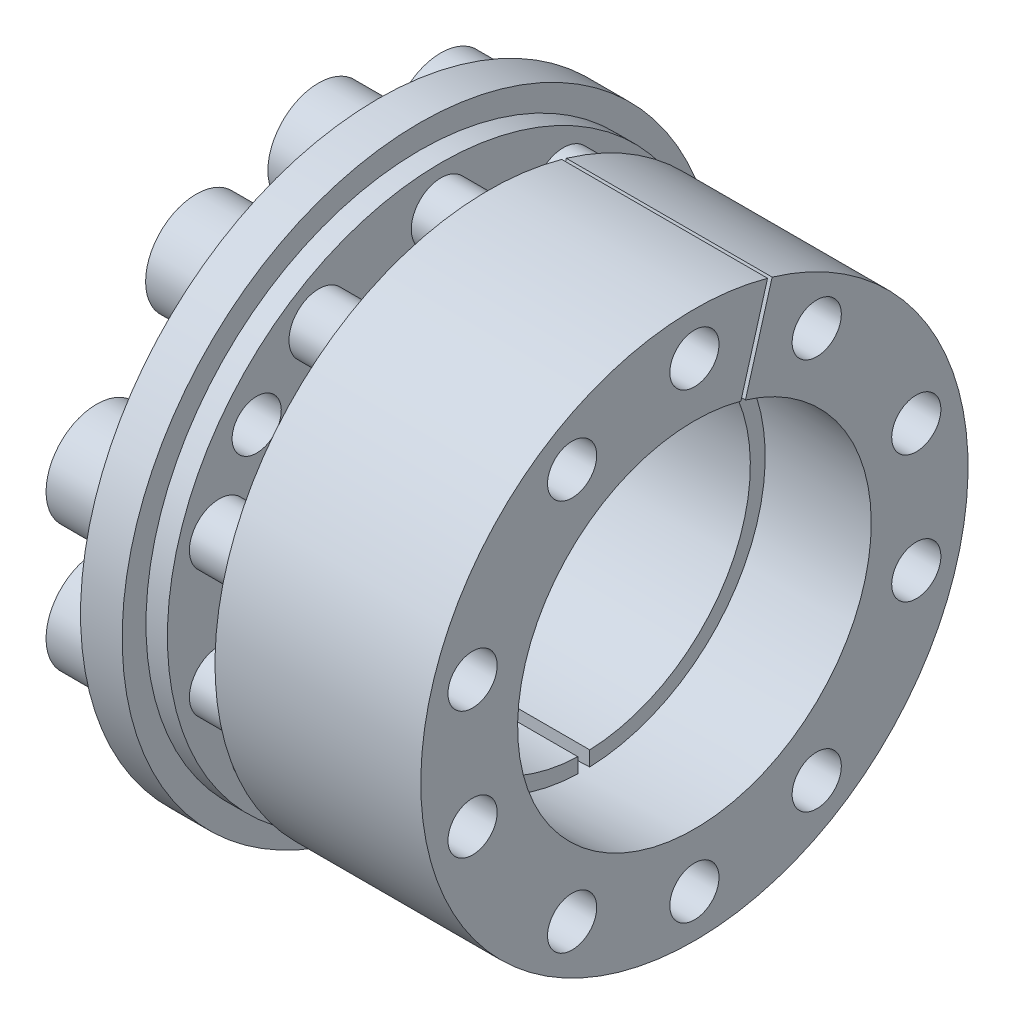
from build123d import *

# Parameters (mm, degrees)
CUT_EXTRUDE1_DEPTH  = 12
SKETCH6_R           = 4.25
BOSS_EXTRUDE1_DEPTH = 5
SKETCH7_R           = 2.067
CUT_EXTRUDE2_DEPTH  = 40.361021372
SKETCH8_R           = 2.5
BOSS_EXTRUDE2_DEPTH = 18
CUT_EXTRUDE3_DEPTH  = 2
TAP1_D              = 4.134
TAP1_DEPTH          = 5.3


with BuildPart() as part:
    # Sketch1 → Revolve1 (revolve)
    with BuildSketch(Plane.XY, mode=Mode.PRIVATE) as revolve1_sk:
        Polygon((-26.6, -14), (-9.3, -14), (-9.3, -15.25), (-21.3, -15.75), (-21.3, -23), (-23.1, -23), (-23.1, -25), (-26.6, -25), align=None)
    revolve(revolve1_sk.sketch.rotate(Axis((0, 0, 0), (-1, 0, 0)), 180), axis=Axis((0, 0, 0), (-1, 0, 0)))

    # Sketch2 → Cut-Extrude1 (cut)
    with BuildSketch(Plane(origin=(-9.3, 0, 0), x_dir=(0, 0, -1), z_dir=(1, 0, 0))):
        with BuildLine():
            Line((0.5, -13.99106858), (0.5, -15.742061491))
            ThreePointArc((0.5, -15.742061491), (0, -15.75), (-0.5, -15.742061491))
            Line((-0.5, -15.742061491), (-0.5, -13.99106858))
            ThreePointArc((-0.5, -13.99106858), (0, -14), (0.5, -13.99106858))
        make_face()
    extrude(amount=-CUT_EXTRUDE1_DEPTH, mode=Mode.SUBTRACT)

    # Sketch3 → Revolve2 (revolve)
    with BuildSketch(Plane.XY, mode=Mode.PRIVATE) as revolve2_sk:
        Polygon((-17.3, -15.583333333), (0, -14.8625), (0, -23), (-17.3, -23), align=None)
    revolve(revolve2_sk.sketch.rotate(Axis((0, 0, 0), (-1, 0, 0)), 358.161317169), axis=Axis((0, 0, 0), (-1, 0, 0)))

    # Sketch4 for Cut-Loft1 → Cut-Loft1 section 0
    with BuildSketch(Plane(origin=(0, 0, 0), x_dir=(0, 0, -1), z_dir=(1, 0, 0))):
        with BuildLine():
            Line((6.531671834, 22.05305564), (4.288541607, 14.230330886))
            # circular arc as an exact rational Bezier (weights 1, cos(half-angle), 1)
            Bezier((4.288541607, 14.230330886), (4.097031168, 14.288045671), (3.904036928, 14.340585829), weights=[1, 0.999909455, 1])
            Line((3.904036928, 14.340585829), (6.147167155, 22.163310582))
            Bezier((6.147167155, 22.163310582), (6.339898882, 22.109854934), (6.531671834, 22.05305564), weights=[1, 0.999962192, 1])
        make_face()
    # Sketch5 for Cut-Loft1 → Cut-Loft1 section 1
    with BuildSketch(Plane.ZY.offset(17.3)):
        with BuildLine():
            Line((-6.531671834, 22.05305564), (-4.48724736, 14.923300202))
            Bezier((-4.48724736, 14.923300202), (-4.295702598, 14.980895286), (-4.102742682, 15.033555144), weights=[1, 0.999917638, 1])
            Line((-4.102742682, 15.033555144), (-6.147167155, 22.163310582))
            Bezier((-6.147167155, 22.163310582), (-6.339898882, 22.109854934), (-6.531671834, 22.05305564), weights=[1, 0.999962192, 1])
        make_face()
    loft(mode=Mode.SUBTRACT)

    # Sketch6 → Boss-Extrude1 (add)
    with BuildSketch(Plane.ZY.offset(26.6)):
        with Locations(Location((0, 19.4, 0), (0, 0, 90))):
            Circle(SKETCH6_R)
        with Locations(Location((10.280433726, -16.452133065, 0), (0, 0, 90))):
            Circle(SKETCH6_R)
        with Locations(Location((0, -19.4, 0), (0, 0, 90))):
            Circle(SKETCH6_R)
        with Locations(Location((-10.280433726, 16.452133065, 0), (0, 0, 90))):
            Circle(SKETCH6_R)
        with Locations(Location((10.280433726, 16.452133065, 0), (0, 0, 90))):
            Circle(SKETCH6_R)
        with Locations(Location((-10.280433726, -16.452133065, 0), (0, 0, 90))):
            Circle(SKETCH6_R)
        with Locations(Location((-18.648476901, 5.347364703, 0), (0, 0, 90))):
            Circle(SKETCH6_R)
        with Locations(Location((18.648476901, -5.347364703, 0), (0, 0, 90))):
            Circle(SKETCH6_R)
        with Locations(Location((18.648476901, 5.347364703, 0), (0, 0, 90))):
            Circle(SKETCH6_R)
        with Locations(Location((-18.648476901, -5.347364703, 0), (0, 0, 90))):
            Circle(SKETCH6_R)
    extrude(amount=BOSS_EXTRUDE1_DEPTH)

    # Sketch7 → Cut-Extrude2 (cut, through all)
    with BuildSketch(Plane.ZY.offset(17.3)):
        with Locations(Location((0, 19.4, 0), (0, 0, 270))):
            Circle(SKETCH7_R)
        with Locations(Location((10.280433726, -16.452133065, 0), (0, 0, 270))):
            Circle(SKETCH7_R)
        with Locations(Location((0, -19.4, 0), (0, 0, 270))):
            Circle(SKETCH7_R)
        with Locations(Location((-10.280433726, 16.452133065, 0), (0, 0, 270))):
            Circle(SKETCH7_R)
        with Locations(Location((10.280433726, 16.452133065, 0), (0, 0, 270))):
            Circle(SKETCH7_R)
        with Locations(Location((-10.280433726, -16.452133065, 0), (0, 0, 270))):
            Circle(SKETCH7_R)
        with Locations(Location((-18.648476901, 5.347364703, 0), (0, 0, 270))):
            Circle(SKETCH7_R)
        with Locations(Location((18.648476901, -5.347364703, 0), (0, 0, 270))):
            Circle(SKETCH7_R)
        with Locations(Location((18.648476901, 5.347364703, 0), (0, 0, 270))):
            Circle(SKETCH7_R)
        with Locations(Location((-18.648476901, -5.347364703, 0), (0, 0, 270))):
            Circle(SKETCH7_R)
    extrude(amount=-CUT_EXTRUDE2_DEPTH, mode=Mode.SUBTRACT)

    # Sketch8 → Boss-Extrude2 (add)
    with BuildSketch(Plane.ZY.offset(26.6)):
        with Locations(Location((0, 19.4, 0), (0, 0, 270))):
            Circle(SKETCH8_R)
        with Locations(Location((10.280433726, -16.452133065, 0), (0, 0, 270))):
            Circle(SKETCH8_R)
        with Locations(Location((0, -19.4, 0), (0, 0, 270))):
            Circle(SKETCH8_R)
        with Locations(Location((-10.280433726, 16.452133065, 0), (0, 0, 270))):
            Circle(SKETCH8_R)
        with Locations(Location((10.280433726, 16.452133065, 0), (0, 0, 270))):
            Circle(SKETCH8_R)
        with Locations(Location((-10.280433726, -16.452133065, 0), (0, 0, 270))):
            Circle(SKETCH8_R)
        with Locations(Location((-18.648476901, 5.347364703, 0), (0, 0, 270))):
            Circle(SKETCH8_R)
        with Locations(Location((18.648476901, -5.347364703, 0), (0, 0, 270))):
            Circle(SKETCH8_R)
        with Locations(Location((18.648476901, 5.347364703, 0), (0, 0, 270))):
            Circle(SKETCH8_R)
        with Locations(Location((-18.648476901, -5.347364703, 0), (0, 0, 270))):
            Circle(SKETCH8_R)
    extrude(amount=-BOSS_EXTRUDE2_DEPTH)

    # Sketch9 → Cut-Extrude3 (cut)
    with BuildSketch(Plane.ZY.offset(31.6)):
        Polygon((0, 21.709401077), (-2, 20.554700538), (-2, 18.245299462), (0, 17.090598923), (2, 18.245299462), (2, 20.554700538), align=None)
        Polygon((10.280433726, -14.142731989), (8.280433726, -15.297432527), (8.280433726, -17.606833604), (10.280433726, -18.761534142), (12.280433726, -17.606833604), (12.280433726, -15.297432527), align=None)
        Polygon((0, -17.090598923), (-2, -18.245299462), (-2, -20.554700538), (0, -21.709401077), (2, -20.554700538), (2, -18.245299462), align=None)
        Polygon((-10.280433726, 18.761534142), (-12.280433726, 17.606833604), (-12.280433726, 15.297432527), (-10.280433726, 14.142731989), (-8.280433726, 15.297432527), (-8.280433726, 17.606833604), align=None)
        Polygon((10.280433726, 18.761534142), (8.280433726, 17.606833604), (8.280433726, 15.297432527), (10.280433726, 14.142731989), (12.280433726, 15.297432527), (12.280433726, 17.606833604), align=None)
        Polygon((-10.280433726, -14.142731989), (-12.280433726, -15.297432527), (-12.280433726, -17.606833604), (-10.280433726, -18.761534142), (-8.280433726, -17.606833604), (-8.280433726, -15.297432527), align=None)
        Polygon((-18.648476901, 7.65676578), (-20.648476901, 6.502065241), (-20.648476901, 4.192664164), (-18.648476901, 3.037963626), (-16.648476901, 4.192664164), (-16.648476901, 6.502065241), align=None)
        Polygon((18.648476901, -3.037963626), (16.648476901, -4.192664164), (16.648476901, -6.502065241), (18.648476901, -7.65676578), (20.648476901, -6.502065241), (20.648476901, -4.192664164), align=None)
        Polygon((18.648476901, 7.65676578), (16.648476901, 6.502065241), (16.648476901, 4.192664164), (18.648476901, 3.037963626), (20.648476901, 4.192664164), (20.648476901, 6.502065241), align=None)
        Polygon((-18.648476901, -3.037963626), (-20.648476901, -4.192664164), (-20.648476901, -6.502065241), (-18.648476901, -7.65676578), (-16.648476901, -6.502065241), (-16.648476901, -4.192664164), align=None)
    extrude(amount=-CUT_EXTRUDE3_DEPTH, mode=Mode.SUBTRACT)

    # Tap1
    with Locations(Plane.ZY.offset(26.6)):
        with Locations((15.493528895, 11.675211449), (-15.493528895, -11.675211449), (-15.493528895, 11.675211449), (15.493528895, -11.675211449)):
            Hole(TAP1_D / 2, depth=TAP1_DEPTH)


solid = part.part
